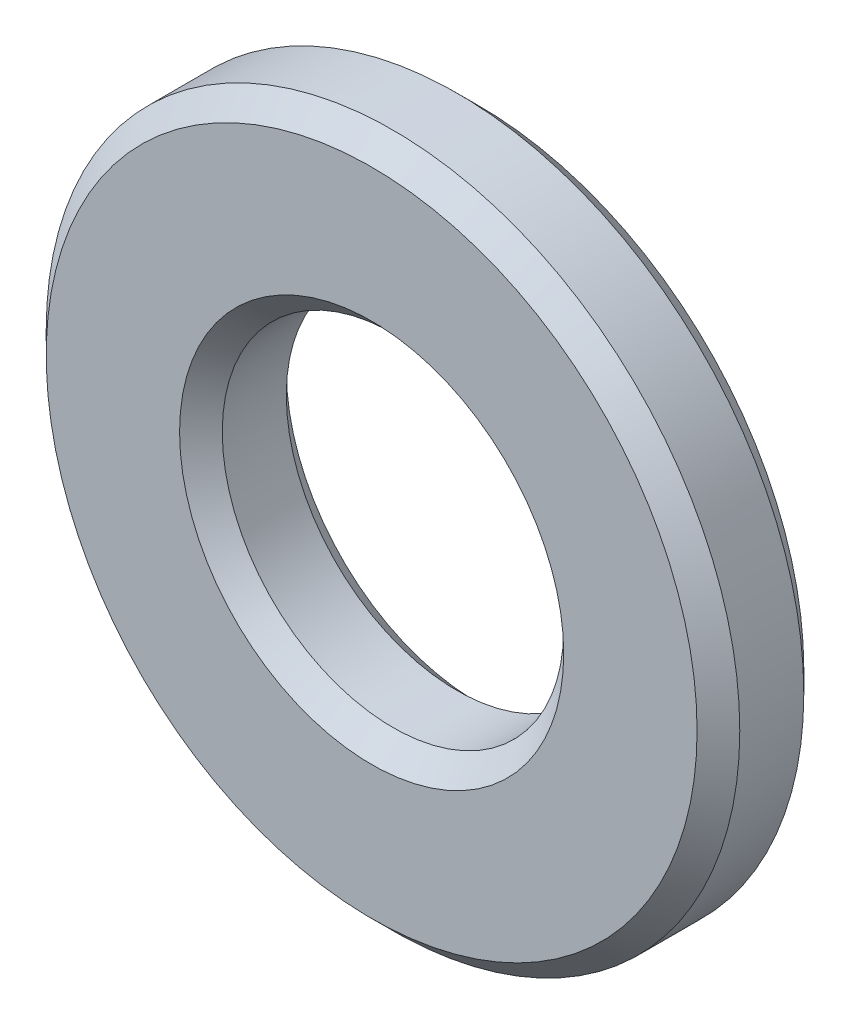
from build123d import *

# Parameters (mm, degrees)
SKETCH_1_R      = 32.5
SKETCH_1_R_2    = 16
EXTRUDE_1_DEPTH = 10
CHAMFER_1_SIZE  = 2


with BuildPart() as part:
    # 草图1 → 凸台-拉伸1 (new body)
    with BuildSketch(Plane.XY):
        Circle(SKETCH_1_R)
        Circle(SKETCH_1_R_2, mode=Mode.SUBTRACT)
    extrude(amount=EXTRUDE_1_DEPTH)

    # 倒角1
    chamfer_1_edges = [part.edges().sort_by_distance(p)[0] for p in [
        (-32.5, 0, 0),
        (-32.5, 0, 10),
        (-16, 0, 0),
        (-16, 0, 10),
    ]]
    chamfer(chamfer_1_edges, length=CHAMFER_1_SIZE)


solid = part.part
